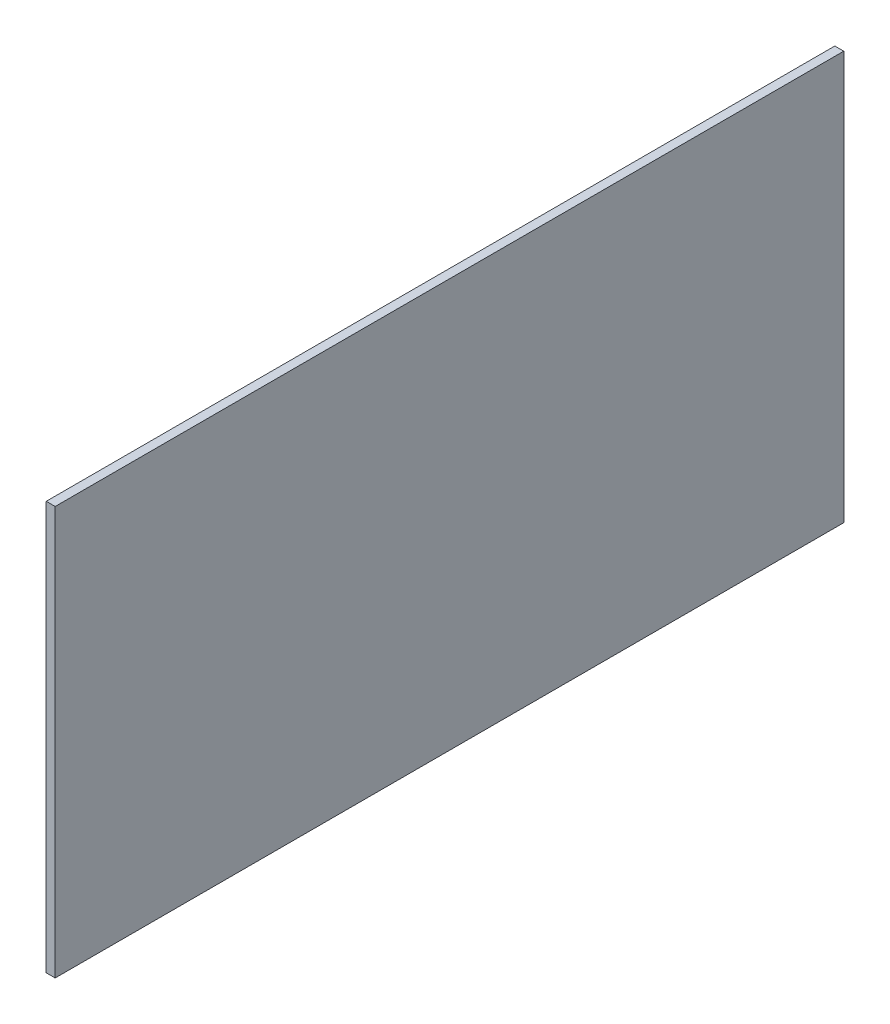
from build123d import *

# Parameters (mm, degrees)
ESQUISSE1_W        = 280
ESQUISSE1_H        = 145
BOSS_EXTRU_1_DEPTH = 3.175


with BuildPart() as part:
    # Esquisse1 → Boss.-Extru.1 (new body)
    with BuildSketch(Plane(origin=(0, 0, 0), x_dir=(0, 0, -1), z_dir=(1, 0, 0))):
        Rectangle(ESQUISSE1_W, ESQUISSE1_H)
    extrude(amount=BOSS_EXTRU_1_DEPTH)


solid = part.part
